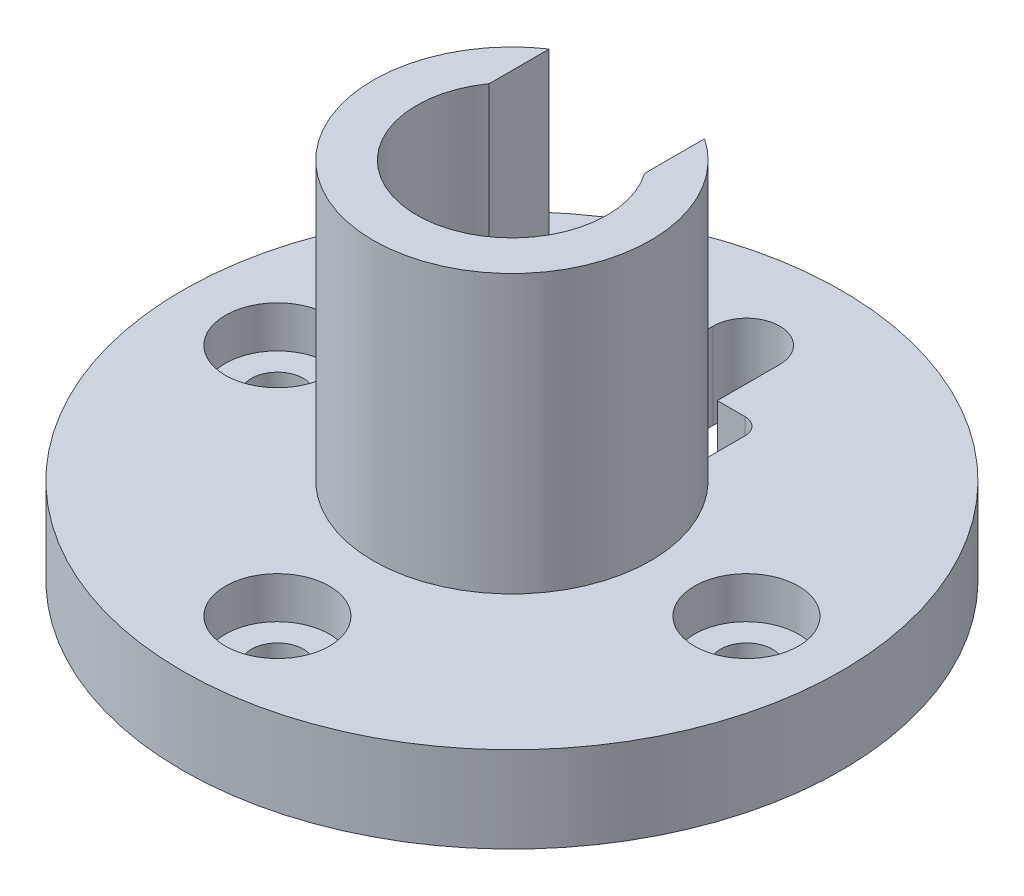
from build123d import *

# Parameters (mm, degrees)
SKETCH1_R           = 60.325
BOSS_EXTRUDE1_DEPTH = 15.748
SKETCH2_R           = 9.525
CUT_EXTRUDE1_DEPTH  = 7.62
SKETCH3_R           = 4.7625
CUT_EXTRUDE2_DEPTH  = 86.698749314
SKETCH4_R           = 25.4
BOSS_EXTRUDE2_DEPTH = 50.8
SKETCH5_R           = 17.4244
CUT_EXTRUDE3_DEPTH  = 109.198186464
CUT_EXTRUDE4_DEPTH  = 109.198186464
FILLET1_R           = 3.048


with BuildPart() as part:
    # Sketch1 → Boss-Extrude1 (new body)
    with BuildSketch(Plane(origin=(0, 0, 0), x_dir=(1, 0, 0), z_dir=(0, 1, 0))):
        with Locations(Location((0, 0, 0), (0, 0, 270))):
            Circle(SKETCH1_R)
    extrude(amount=BOSS_EXTRUDE1_DEPTH)

    # Sketch2 → Cut-Extrude1 (cut)
    with BuildSketch(Plane(origin=(0, 15.748, 0), x_dir=(1, 0, 0), z_dir=(0, 1, 0))):
        with Locations(Location((0, -42.926, 0), (0, 0, 270))):
            Circle(SKETCH2_R)
        with Locations(Location((42.926, 0, 0), (0, 0, 270))):
            Circle(SKETCH2_R)
        with Locations(Location((-42.926, 0, 0), (0, 0, 270))):
            Circle(SKETCH2_R)
    extrude(amount=-CUT_EXTRUDE1_DEPTH, mode=Mode.SUBTRACT)

    # Sketch3 → Cut-Extrude2 (cut, through all)
    with BuildSketch(Plane(origin=(0, 8.128, 0), x_dir=(1, 0, 0), z_dir=(0, 1, 0))):
        with Locations(Location((-42.926, 0, 0), (0, 0, 270))):
            Circle(SKETCH3_R)
        with Locations(Location((42.926, 0, 0), (0, 0, 270))):
            Circle(SKETCH3_R)
        with Locations(Location((0, -42.926, 0), (0, 0, 270))):
            Circle(SKETCH3_R)
    extrude(amount=-CUT_EXTRUDE2_DEPTH, mode=Mode.SUBTRACT)

    # Sketch4 → Boss-Extrude2 (add)
    with BuildSketch(Plane(origin=(0, 15.748, 0), x_dir=(1, 0, 0), z_dir=(0, 1, 0))):
        with Locations(Location((0, 0, 0), (0, 0, 270))):
            Circle(SKETCH4_R)
    extrude(amount=BOSS_EXTRUDE2_DEPTH)

    # Sketch5 → Cut-Extrude3 (cut, through all)
    with BuildSketch(Plane(origin=(0, 66.548, 0), x_dir=(1, 0, 0), z_dir=(0, 1, 0))):
        with Locations(Location((0, 0, 0), (0, 0, 270))):
            Circle(SKETCH5_R)
    extrude(amount=-CUT_EXTRUDE3_DEPTH, mode=Mode.SUBTRACT)

    # Sketch7 → Cut-Extrude4 (cut, through all)
    with BuildSketch(Plane(origin=(0, 66.548, 0), x_dir=(1, 0, 0), z_dir=(0, 1, 0))):
        with BuildLine():
            Line((-6.096, 42.926), (-6.096, 31.496))
            Line((-6.096, 31.496), (-14.224, 31.496))
            Line((-14.224, 31.496), (-14.224, 0))
            Line((-14.224, 0), (14.224, 0))
            Line((14.224, 0), (14.224, 31.496))
            Line((14.224, 31.496), (6.096, 31.496))
            Line((6.096, 31.496), (6.096, 42.926))
            ThreePointArc((6.096, 42.926), (0, 49.022), (-6.096, 42.926))
        make_face()
    extrude(amount=-CUT_EXTRUDE4_DEPTH, mode=Mode.SUBTRACT)

    # Fillet1
    fillet1_edges = [part.edges().sort_by_distance(p)[0] for p in [
        (14.224, 7.874, -31.496),
        (-14.224, 7.874, -31.496),
    ]]
    fillet(fillet1_edges, radius=FILLET1_R)


solid = part.part
